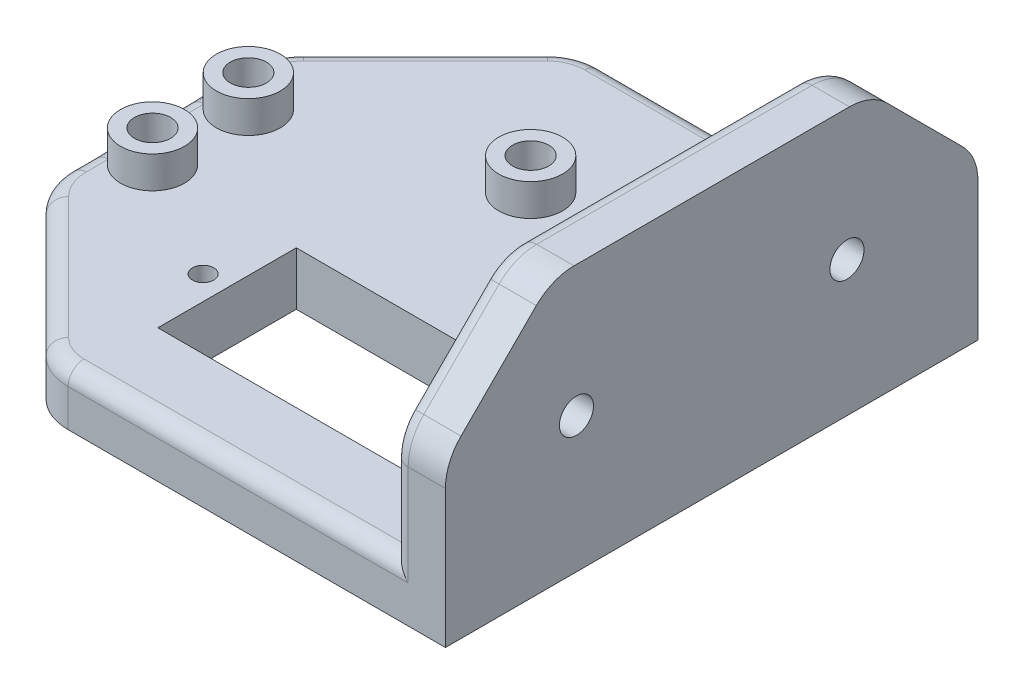
from build123d import *

# Parameters (mm, degrees)
BOSS_EXTRUDE1_DEPTH       = 5
SKETCH2_W                 = 5
SKETCH2_H                 = 50
BOSS_EXTRUDE2_DEPTH       = 10
BOSS_EXTRUDE3_DEPTH       = 5
SKETCH4_R                 = 3
BOSS_EXTRUDE4_DEPTH       = 3
SKETCH5_R                 = 1.7
CUT_EXTRUDE1_DEPTH        = 3
SKETCH6_R                 = 1.65
CUT_EXTRUDE2_DEPTH        = 77.549140495
SKETCH7_R                 = 3
BOSS_EXTRUDE5_DEPTH       = 3
SKETCH8_R                 = 1.7
CUT_EXTRUDE3_DEPTH        = 3
SKETCH9_R                 = 1.65
CUT_EXTRUDE4_DEPTH        = 77.549140495
SKETCH10_W                = 23
SKETCH10_H                = 13
CUT_EXTRUDE5_DEPTH        = 77.549140495
SKETCH11_R                = 3
BOSS_EXTRUDE6_DEPTH       = 3
SKETCH12_R                = 1.7
CUT_EXTRUDE6_DEPTH        = 3
SKETCH13_R                = 1.65
CUT_EXTRUDE7_DEPTH        = 77.549140495
F_1_CLEARANCE_HOLE1_D     = 2
F_1_CLEARANCE_HOLE1_DEPTH = 25
F_4_CLEARANCE_HOLE1_D     = 3.2
FILLET1_R                 = 5
FILLET2_R                 = 5.5
FILLET3_R                 = 1.5


with BuildPart() as part:
    # Sketch1 → Boss-Extrude1 (new body)
    with BuildSketch(Plane(origin=(57.616701934, 0, 0), x_dir=(0, 0, -1), z_dir=(1, 0, 0))):
        Polygon((-6.238297922, 15), (43.761702078, 15), (33.761702078, 25), (3.761702078, 25), align=None)
    extrude(amount=-BOSS_EXTRUDE1_DEPTH)

    # Sketch2 → Boss-Extrude2 (add)
    with BuildSketch(Plane.XZ.offset(-15)):
        with Locations((55.116701934, -18.761702078)):
            Rectangle(SKETCH2_W, SKETCH2_H)
    extrude(amount=BOSS_EXTRUDE2_DEPTH)

    # Sketch3 → Boss-Extrude3 (add)
    with BuildSketch(Plane.XZ.offset(-5)):
        Polygon((5.588924157, -29.2339243), (5.588924157, -8.289479856), (20.116701934, 6.238297922), (57.616701934, 6.238297922), (57.616701934, -43.761702078), (20.116701934, -43.761702078), align=None)
    extrude(amount=BOSS_EXTRUDE3_DEPTH)

    # Sketch4 → Boss-Extrude4 (add)
    with BuildSketch(Plane(origin=(0, 5, 0), x_dir=(-1, 0, 0), z_dir=(0, 1, 0))):
        with Locations(Location((-29.616701934, -29.761702078, 0), (0, 0, 90))):
            Circle(SKETCH4_R)
    extrude(amount=BOSS_EXTRUDE4_DEPTH)

    # Sketch5 → Cut-Extrude1 (cut)
    with BuildSketch(Plane(origin=(0, 8, 0), x_dir=(-1, 0, 0), z_dir=(0, 1, 0))):
        with Locations(Location((-29.616701934, -29.761702078, 0), (0, 0, 270))):
            Circle(SKETCH5_R)
    extrude(amount=-CUT_EXTRUDE1_DEPTH, mode=Mode.SUBTRACT)

    # Sketch6 → Cut-Extrude2 (cut, through all)
    with BuildSketch(Plane.XZ):
        with Locations(Location((29.616701934, -29.761702078, 0), (0, 0, 270))):
            Circle(SKETCH6_R)
    extrude(amount=-CUT_EXTRUDE2_DEPTH, mode=Mode.SUBTRACT)

    # Sketch7 → Boss-Extrude5 (add)
    with BuildSketch(Plane(origin=(0, 5, 0), x_dir=(-1, 0, 0), z_dir=(0, 1, 0))):
        with Locations(Location((-9.616701934, -23.261702078, 0), (0, 0, 90))):
            Circle(SKETCH7_R)
    extrude(amount=BOSS_EXTRUDE5_DEPTH)

    # Sketch8 → Cut-Extrude3 (cut)
    with BuildSketch(Plane(origin=(0, 8, 0), x_dir=(-1, 0, 0), z_dir=(0, 1, 0))):
        with Locations(Location((-9.616701934, -23.261702078, 0), (0, 0, 270))):
            Circle(SKETCH8_R)
    extrude(amount=-CUT_EXTRUDE3_DEPTH, mode=Mode.SUBTRACT)

    # Sketch9 → Cut-Extrude4 (cut, through all)
    with BuildSketch(Plane.XZ):
        with Locations(Location((9.616701934, -23.261702078, 0), (0, 0, 270))):
            Circle(SKETCH9_R)
    extrude(amount=-CUT_EXTRUDE4_DEPTH, mode=Mode.SUBTRACT)

    # Sketch10 → Cut-Extrude5 (cut, through all)
    with BuildSketch(Plane.XZ):
        with Locations((34.616701934, -7.761702078)):
            Rectangle(SKETCH10_W, SKETCH10_H)
    extrude(amount=-CUT_EXTRUDE5_DEPTH, mode=Mode.SUBTRACT)

    # Sketch11 → Boss-Extrude6 (add)
    with BuildSketch(Plane(origin=(0, 5, 0), x_dir=(-1, 0, 0), z_dir=(0, 1, 0))):
        with Locations(Location((-9.616701934, -14.261702078, 0), (0, 0, 90))):
            Circle(SKETCH11_R)
    extrude(amount=BOSS_EXTRUDE6_DEPTH)

    # Sketch12 → Cut-Extrude6 (cut)
    with BuildSketch(Plane(origin=(0, 8, 0), x_dir=(-1, 0, 0), z_dir=(0, 1, 0))):
        with Locations(Location((-9.616701934, -14.261702078, 0), (0, 0, 270))):
            Circle(SKETCH12_R)
    extrude(amount=-CUT_EXTRUDE6_DEPTH, mode=Mode.SUBTRACT)

    # Sketch13 → Cut-Extrude7 (cut, through all)
    with BuildSketch(Plane.XZ):
        with Locations(Location((9.616701934, -14.261702078, 0), (0, 0, 270))):
            Circle(SKETCH13_R)
    extrude(amount=-CUT_EXTRUDE7_DEPTH, mode=Mode.SUBTRACT)

    # #1 Clearance Hole1
    with Locations(Plane(origin=(0, 0, 0), x_dir=(-1, 0, 0), z_dir=(0, -1, 0))):
        with Locations((-48.366701934, 7.761702078), (-20.866701934, 7.761702078)):
            Hole(F_1_CLEARANCE_HOLE1_D / 2, depth=F_1_CLEARANCE_HOLE1_DEPTH)

    # #4 Clearance Hole1 (through all)
    with Locations(Plane(origin=(57.616701934, 0, 0), x_dir=(0, 0, -1), z_dir=(1, 0, 0))):
        with Locations((31.461702078, 12.7), (6.061702078, 12.7)):
            Hole(F_4_CLEARANCE_HOLE1_D / 2)

    # Fillet1
    fillet1_edges = [part.edges().sort_by_distance(p)[0] for p in [
        (20.116701934, 2.5, -43.761702078),
        (20.116701934, 2.5, 6.238297922),
        (55.116701934, 25, -3.761702078),
        (55.116701934, 25, -33.761702078),
        (55.116701934, 15, -43.761702078),
        (55.116701934, 15, 6.238297922),
    ]]
    fillet(fillet1_edges, radius=FILLET1_R)

    # Fillet2
    fillet2_edges = [part.edges().sort_by_distance(p)[0] for p in [
        (5.588924157, 2.5, -29.2339243),
        (5.588924157, 2.5, -8.289479856),
    ]]
    fillet(fillet2_edges, radius=FILLET2_R)

    # Fillet3
    fillet3_edges = [part.edges().sort_by_distance(p)[0] for p in [
        (52.616701934, 25, -18.761702078),
        (52.616701934, 20, 1.238297922),
        (52.616701934, 20, -38.761702078),
        (52.616701934, 14.84234935, 5.857695585),
        (52.616701934, 24.619397663, -33.604051428),
        (52.616701934, 14.84234935, -43.38109974),
        (52.616701934, 8.964466094, -43.761702078),
        (52.616701934, 24.619397663, -3.919352728),
        (37.40223584, 5, -43.761702078),
        (12.92603635, 5, -0.952367662),
        (20.274352584, 5, 5.857695585),
        (20.274352584, 5, -43.38109974),
        (52.616701934, 8.964466094, 6.238297922),
        (5.588924157, 5, -18.761702078),
        (12.92603635, 5, -36.571036494),
        (6.007586728, 5, -29.060508585),
        (6.007586728, 5, -8.462895571),
        (37.40223584, 5, 6.238297922),
    ]]
    fillet(fillet3_edges, radius=FILLET3_R)


solid = part.part
